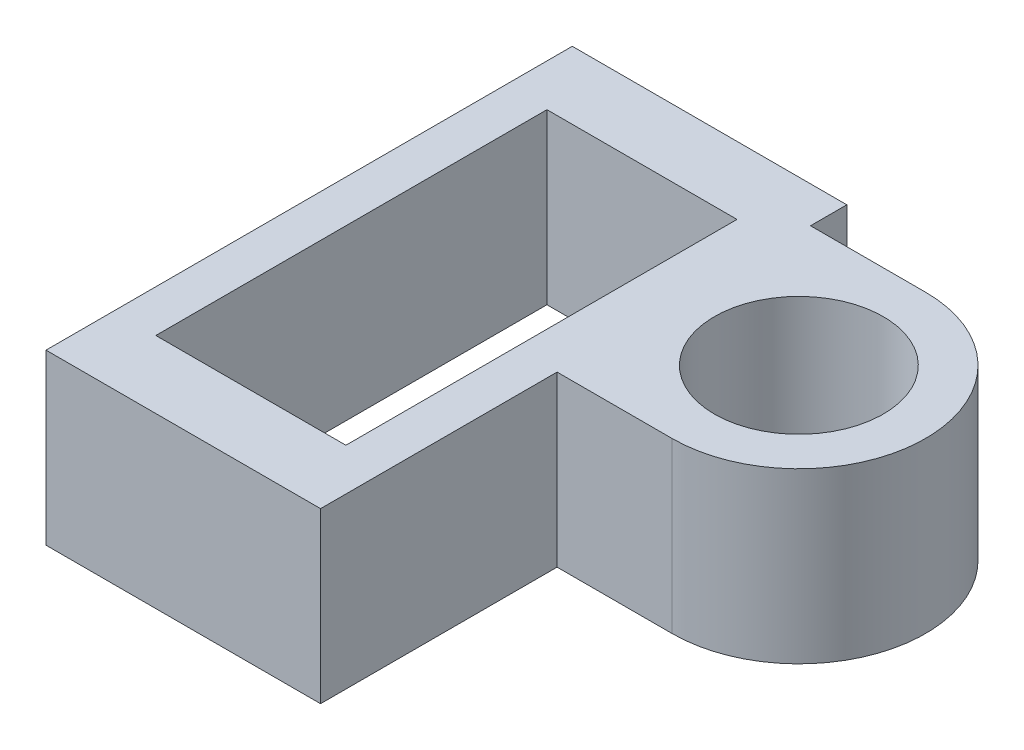
from build123d import *

# Parameters (mm, degrees)
SKETCH1_W           = 82.0674
SKETCH1_H           = 79.121
SKETCH1_R           = 12.7
SKETCH1_W_2         = 28.575
SKETCH1_H_2         = 58.801
BOSS_EXTRUDE1_DEPTH = 25.4
CUT_EXTRUDE1_REACH  = 118.792


with BuildPart() as part:
    # Sketch1 → Boss-Extrude1 (new body)
    with BuildSketch(Plane(origin=(0, 0, 0), x_dir=(1, 0, 0), z_dir=(0, 1, 0))):
        with Locations((-41.0337, 39.5605)):
            Rectangle(SKETCH1_W, SKETCH1_H)
        with Locations(Location((-23.495, 54.61, 0), (0, 0, 270))):
            Circle(SKETCH1_R, mode=Mode.SUBTRACT)
        with Locations((-61.4299, 39.5605)):
            Rectangle(SKETCH1_W_2, SKETCH1_H_2, mode=Mode.SUBTRACT)
    extrude(amount=BOSS_EXTRUDE1_DEPTH)

    # Sketch2 → Cut-Extrude1 (cut, up to next)
    with BuildSketch(Plane(origin=(0, 25.4, 0), x_dir=(1, 0, 0), z_dir=(0, 1, 0)), mode=Mode.PRIVATE) as cut_extrude1_sk1:
        with BuildLine():
            Line((-40.7924, 0), (-40.7924, 35.56))
            Line((-40.7924, 35.56), (-23.495, 35.56))
            ThreePointArc((-23.495, 35.56), (-4.445, 54.61), (-23.495, 73.66))
            Line((-23.495, 73.66), (-40.7924, 73.66))
            Line((-40.7924, 73.66), (-40.7924, 79.121))
            Line((-40.7924, 79.121), (0, 79.121))
            Line((0, 79.121), (0, 0))
            Line((0, 0), (-40.7924, 0))
        make_face()
    cut_extrude1_tool1 = extrude(cut_extrude1_sk1.sketch, amount=-CUT_EXTRUDE1_REACH, mode=Mode.PRIVATE) & part.part
    add(cut_extrude1_tool1.solids().sort_by_distance((-17.944529, 25.4, -30.304871))[0], mode=Mode.SUBTRACT)


solid = part.part
